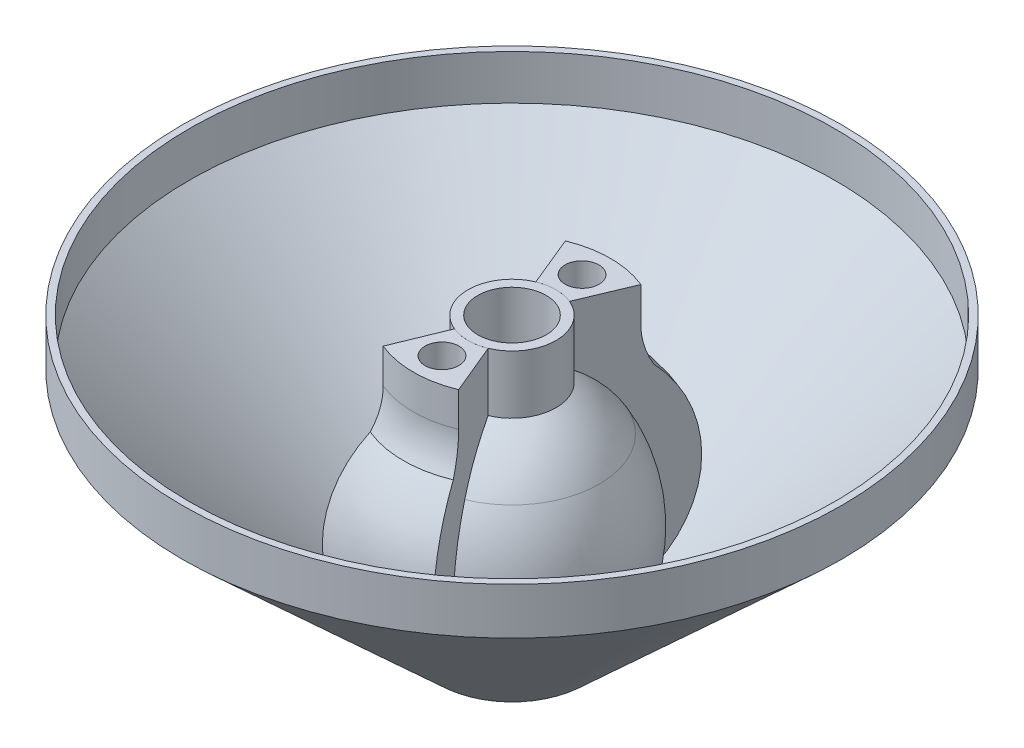
from build123d import *

# Parameters (mm, degrees)
REVOLVE9_ANGLE     = 45
CUT_REVOLVE4_ANGLE = 30
SKETCH11_R         = 2.5
CUT_EXTRUDE1_DEPTH = 8.51
CIRPATTERN12_COUNT = 2
CIRPATTERN12_ANGLE = 180


with BuildPart() as part:
    # Sketch1 → Revolve7 (revolve)
    with BuildSketch(Plane(origin=(0, 0, 0), x_dir=(0, 0, -1), z_dir=(1, 0, 0))):
        with BuildLine():
            Line((-48.728965868, 20.832969512), (-48.728965868, 13.935351474))
            Line((-48.728965868, 13.935351474), (-10.868218023, -21.002728962))
            ThreePointArc((-10.868218023, -21.002728962), (-10.348629683, -20.851331552), (-10.08827938, -20.376872978))
            ThreePointArc((-10.08827938, -20.376872978), (-15.012065486, -7.916347865), (-12.042463906, 5.148483636))
            ThreePointArc((-12.042463906, 5.148483636), (-9.022117121, 9.01533709), (-5.052546128, 11.89935451))
            Line((-5.052546128, 11.89935451), (-5.052546128, 20.832969512))
            Line((-5.052546128, 20.832969512), (-6.502327374, 20.832969512))
            Line((-6.502327374, 20.832969512), (-6.502327374, 12.22238818))
            ThreePointArc((-6.502327374, 12.22238818), (-10.116921129, 9.336316239), (-12.908583913, 5.648319742))
            ThreePointArc((-12.908583913, 5.648319742), (-15.998407125, -4.242970239), (-14.56779001, -14.506398498))
            ThreePointArc((-14.56779001, -14.506398498), (-14.950644997, -15.690812149), (-16.190863193, -15.584640294))
            Line((-16.190863193, -15.584640294), (-47.728965868, 14.221691717))
            Line((-47.728965868, 14.221691717), (-47.728965868, 20.832969512))
            Line((-47.728965868, 20.832969512), (-48.728965868, 20.832969512))
        make_face()
    revolve(axis=Axis((0, 0, 0), (0, -1, 0)))


with BuildPart() as body_2:
    # Sketch4 → Revolve9 (revolve, symmetric)
    with BuildSketch(Plane(origin=(0, 0, 0), x_dir=(0, 0, -1), z_dir=(1, 0, 0))) as revolve9_sk:
        with BuildLine():
            Line((-14.570569368, 15.718420336), (-14.570569368, 20.807254449))
            Line((-14.570569368, 20.807254449), (-6.502327374, 20.832969512))
            Line((-6.502327374, 20.832969512), (-6.502327374, 12.22238818))
            ThreePointArc((-6.502327374, 12.22238818), (-10.116921129, 9.336316239), (-12.908583913, 5.648319742))
            ThreePointArc((-12.908583913, 5.648319742), (-15.998407125, -4.242970239), (-14.56779001, -14.506398498))
            ThreePointArc((-14.56779001, -14.506398498), (-14.950644997, -15.690812149), (-16.190863193, -15.584640294))
            ThreePointArc((-16.190863193, -15.584640294), (-21.461479745, -2.652102831), (-16.043683511, 10.219470812))
            ThreePointArc((-16.043683511, 10.219470812), (-14.945228328, 12.871996653), (-14.570569368, 15.718420336))
        make_face()
    revolve(axis=Axis((0, 0, 0), (0, -1, 0)), revolution_arc=REVOLVE9_ANGLE / 2)
    revolve(revolve9_sk.sketch, axis=Axis((0, 0, 0), (0, 1, 0)), revolution_arc=REVOLVE9_ANGLE / 2)

    # Sketch6 → Cut-Revolve4 (revolve, symmetric, cut)
    with BuildSketch(Plane(origin=(0, 0, 0), x_dir=(0, 0, -1), z_dir=(1, 0, 0))) as cut_revolve4_sk:
        with BuildLine():
            Line((-7.716145203, 12.222388181), (-12.945489314, 12.222388181))
            add(Edge.make_bspline(
                [(-13.940053312, 9.748928646), (-13.523208862, 10.530610277), (-13.189220448, 11.362047549), (-12.945489314, 12.222388181)],
                knots=[0, 0, 0, 0, 0.431853982, 0.431853982, 0.431853982, 0.431853982], degree=3))
            add(Edge.make_bspline(
                [(-13.940053312, 9.748928646), (-14.750450606, 8.90582924), (-15.479096406, 7.968006307), (-16.692933114, 6.018989935), (-17.19205196, 5.018323095), (-18.000850507, 2.928791742), (-18.310500826, 1.839985913), (-18.727660543, -0.383261683), (-18.835154906, -1.517638969), (-18.843564612, -3.787442276), (-18.74447963, -4.922801953), (-18.345651032, -7.139576798), (-18.047796528, -8.221332052), (-17.656555861, -9.260934811)],
                knots=[-0.009929664, -0.009929664, -0.009929664, -0.009929664, 0.125, 0.125, 0.25, 0.25, 0.375, 0.375, 0.5, 0.5, 0.625, 0.625, 0.748837317, 0.748837317, 0.748837317, 0.748837317], degree=3))
            ThreePointArc((-17.656555861, -9.260934811), (-16.949263483, -8.764531149), (-16.800142642, -7.913389518))
            add(Edge.make_bspline(
                [(-13.690802755, 6.589270425), (-14.561232238, 4.956712144), (-15.263150899, 3.222654884), (-16.298812961, -0.365920093), (-16.632541101, -2.220326712), (-16.87151395, -5.362351533), (-16.879835371, -6.641000676), (-16.800142642, -7.913389518)],
                knots=[0, 0, 0, 0, 0.25, 0.25, 0.5, 0.5, 0.669839538, 0.669839538, 0.669839538, 0.669839538], degree=3))
            ThreePointArc((-13.690802755, 6.589270425), (-11.163053443, 9.893273385), (-7.716145203, 12.222388181))
        make_face()
    revolve(axis=Axis((0, 0, 0), (0, -1, 0)), revolution_arc=CUT_REVOLVE4_ANGLE / 2, mode=Mode.SUBTRACT)
    revolve(cut_revolve4_sk.sketch, axis=Axis((0, 0, 0), (0, 1, 0)), revolution_arc=CUT_REVOLVE4_ANGLE / 2, mode=Mode.SUBTRACT)

    # Sketch11 → Cut-Extrude1 (cut)
    with BuildSketch(Plane(origin=(0.004743566, 20.853654192, 0.011451982), x_dir=(0.9999992561876918, -0.001219680629848948, -1.79572176268189e-06), z_dir=(-0.0012196806298489479, -0.9999949209318579, -0.0029445695183450836))):
        with Locations(Location((0.020691256, 10.366236436, 0), (0, 0, 225.194076658))):
            Circle(SKETCH11_R)
    extrude(amount=CUT_EXTRUDE1_DEPTH, mode=Mode.SUBTRACT)


with BuildPart() as cirpattern12_1:
    # CirPattern12: pattern copy
    add(body_2.part.rotate(Axis((0, 0, 0), (0, -1, 0)), 1 * CIRPATTERN12_ANGLE / (CIRPATTERN12_COUNT - 1)))


solid = Compound([part.part, body_2.part, cirpattern12_1.part])
